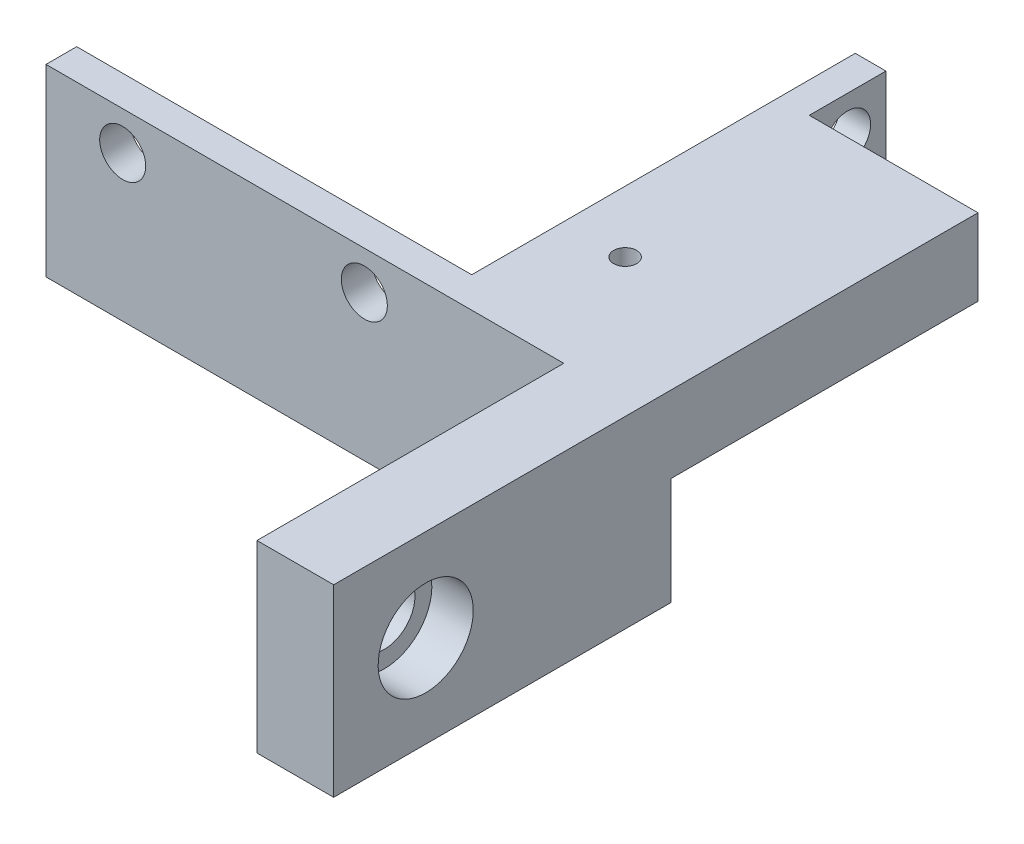
from build123d import *

# Parameters (mm, degrees)
SKETCH_1_W          = 25.75
SKETCH_1_H          = 2
EXTRUDE_1_DEPTH     = 5
SKETCH_2_W          = 13
SKETCH_2_H          = 5
EXTRUDE_2_DEPTH     = 22
SKETCH_2_3_W        = 5
SKETCH_2_3_H        = 5
EXTRUDE_3_DEPTH     = 20
SKETCH_3_W          = 5
SKETCH_3_H          = 20
EXTRUDE_4_DEPTH     = 7
SKETCH_4_R          = 2
CUT_EXTRUDE_1_DEPTH = 46.106124861
SKETCH_4_3_R        = 3.1
CUT_EXTRUDE_2_DEPTH = 2.7
SKETCH_5_W          = 5
SKETCH_5_H          = 5
SKETCH_5_R          = 1.5
EXTRUDE_5_DEPTH     = 2
SKETCH_6_R          = 1.5
CUT_EXTRUDE_3_DEPTH = 38.961329007
SKETCH_7_R          = 0.75
CUT_EXTRUDE_4_DEPTH = 40.192633236


with BuildPart() as part:
    # 草图1 → 凸台-拉伸1 (new body)
    with BuildSketch(Plane(origin=(0, 0, 0), x_dir=(1, 0, 0), z_dir=(0, 1, 0))):
        with Locations((-12.875, 1)):
            Rectangle(SKETCH_1_W, SKETCH_1_H)
    extrude(amount=EXTRUDE_1_DEPTH)

    # 草图2 → 凸台-拉伸2 (add)
    with BuildSketch(Plane(origin=(0, 0, 0), x_dir=(-1, 0, 0), z_dir=(0, 0, -1))):
        with Locations((-6.5, 2.5)):
            Rectangle(SKETCH_2_W, SKETCH_2_H)
    extrude(amount=EXTRUDE_2_DEPTH)

    # 草图2<3> → 凸台-拉伸3 (add)
    with BuildSketch(Plane(origin=(0, 0, 0), x_dir=(-1, 0, 0), z_dir=(0, 0, -1))):
        with Locations((-10.5, 2.5)):
            Rectangle(SKETCH_2_3_W, SKETCH_2_3_H)
    extrude(amount=-EXTRUDE_3_DEPTH)

    # 草图3 → 凸台-拉伸4 (add)
    with BuildSketch(Plane.XZ):
        Polygon((8, 0), (-25.75, 0), (-25.75, -2), (13, -2), (13, 0), align=None)
        with Locations((10.5, 10)):
            Rectangle(SKETCH_3_W, SKETCH_3_H)
    extrude(amount=EXTRUDE_4_DEPTH)

    # 草图4 → 切除-拉伸1 (cut, through all)
    with BuildSketch(Plane(origin=(13, 0, 0), x_dir=(0, 0, -1), z_dir=(1, 0, 0))):
        with Locations((-14, -1)):
            Circle(SKETCH_4_R)
    extrude(amount=-CUT_EXTRUDE_1_DEPTH, mode=Mode.SUBTRACT)

    # 草图4<3> → 切除-拉伸2 (cut)
    with BuildSketch(Plane(origin=(13, 0, 0), x_dir=(0, 0, -1), z_dir=(1, 0, 0))):
        with Locations((-14, -1)):
            Circle(SKETCH_4_3_R)
    extrude(amount=-CUT_EXTRUDE_2_DEPTH, mode=Mode.SUBTRACT)

    # 草图5 → 凸台-拉伸5 (add)
    with BuildSketch(Plane.ZY):
        with Locations((-24.5, 2.5)):
            Rectangle(SKETCH_5_W, SKETCH_5_H)
        with Locations((-24.5, 2.5)):
            Circle(SKETCH_5_R, mode=Mode.SUBTRACT)
    extrude(amount=-EXTRUDE_5_DEPTH)

    # 草图6 → 切除-拉伸3 (cut, through all)
    with BuildSketch(Plane.XY):
        with Locations((-20.75, 2.5)):
            Circle(SKETCH_6_R)
        with Locations((-5, 2.5)):
            Circle(SKETCH_6_R)
    extrude(amount=-CUT_EXTRUDE_3_DEPTH, mode=Mode.SUBTRACT)

    # 草图7 → 切除-拉伸4 (cut, through all)
    with BuildSketch(Plane(origin=(0, 5, 0), x_dir=(1, 0, 0), z_dir=(0, 1, 0))):
        with Locations((4, 8)):
            Circle(SKETCH_7_R)
    extrude(amount=-CUT_EXTRUDE_4_DEPTH, mode=Mode.SUBTRACT)


solid = part.part
